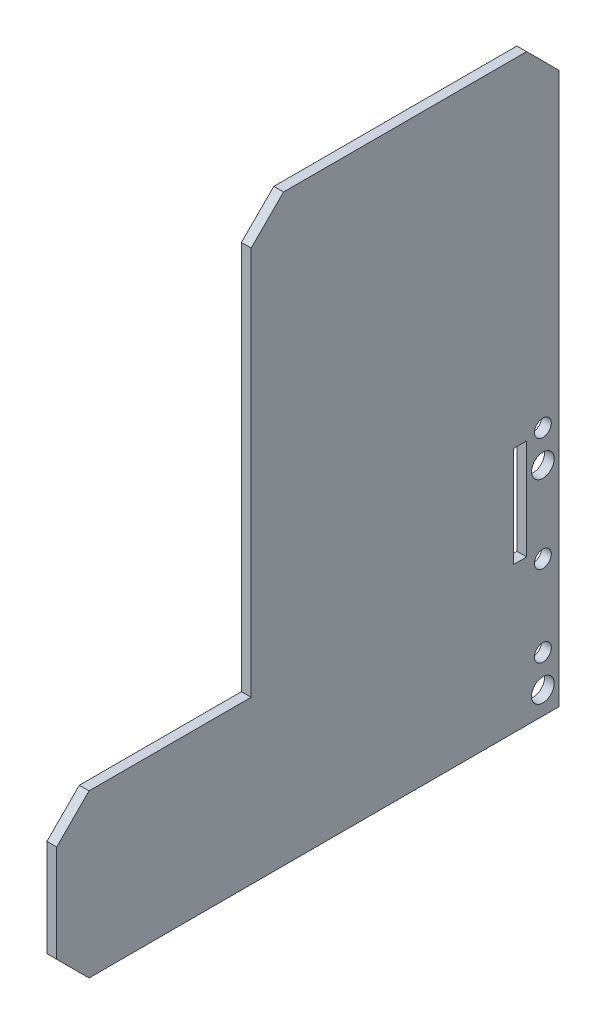
from build123d import *

# Parameters (mm, degrees)
ESQUISSE1_W                            = 77.5
ESQUISSE1_H                            = 90
ESQUISSE1_R                            = 1.75
EXTRUSION1_DEPTH                       = 1.5
FRAISAGE_POUR_VIS_T_TE_FRAIS_E_M2_51_D = 2.59999988
ESQUISSE5_W                            = 2
ESQUISSE5_H                            = 15.5
ENL_V_MAT_EXTRU_1_DEPTH                = 102.922764876
ENL_V_MAT_EXTRU_2_REACH                = 103.923


with BuildPart() as part:
    # Esquisse1 → Extrusion1 (new body)
    with BuildSketch(Plane(origin=(0, 0, 0), x_dir=(0, 0, -1), z_dir=(1, 0, 0))):
        with Locations((-36.25, 24)):
            Rectangle(ESQUISSE1_W, ESQUISSE1_H)
        with Locations((0, -17.5)):
            Circle(ESQUISSE1_R, mode=Mode.SUBTRACT)
        with Locations((0, 12.5)):
            Circle(ESQUISSE1_R, mode=Mode.SUBTRACT)
    extrude(amount=EXTRUSION1_DEPTH)

    # Fraisage pour vis à tête fraisée M2.51 (through all)
    with Locations(Plane(origin=(1.5, 0, 0), x_dir=(0, 0, -1), z_dir=(1, 0, 0))):
        with Locations((0, 17.5), (0, -12.5), (0, 0)):
            Hole(FRAISAGE_POUR_VIS_T_TE_FRAIS_E_M2_51_D / 2)

    # Esquisse5 → Enlèv. mat.-Extru.1 (cut, through all)
    with BuildSketch(Plane.ZY):
        with Locations((3.5, 9.25)):
            Rectangle(ESQUISSE5_W, ESQUISSE5_H)
    extrude(amount=-ENL_V_MAT_EXTRU_1_DEPTH, mode=Mode.SUBTRACT)

    # Esquisse6 → Enlèv. mat.-Extru.2 (cut, up to next)
    with BuildSketch(Plane(origin=(1.5, 0, 0), x_dir=(0, 0, -1), z_dir=(1, 0, 0)), mode=Mode.PRIVATE) as enl_v_mat_extru_2_sk1:
        Polygon((-75, 69), (-75, -1), (-70, 4), (-45, 4), (-45, 64), (-40, 69), align=None)
    enl_v_mat_extru_2_tool1 = extrude(enl_v_mat_extru_2_sk1.sketch, amount=-ENL_V_MAT_EXTRU_2_REACH, mode=Mode.PRIVATE) & part.part
    # Esquisse6 → Enlèv. mat.-Extru.2 (cut, up to next)
    with BuildSketch(Plane(origin=(1.5, 0, 0), x_dir=(0, 0, -1), z_dir=(1, 0, 0)), mode=Mode.PRIVATE) as enl_v_mat_extru_2_sk2:
        Polygon((-75, -21), (-70, -21), (-75, -16), align=None)
    enl_v_mat_extru_2_tool2 = extrude(enl_v_mat_extru_2_sk2.sketch, amount=-ENL_V_MAT_EXTRU_2_REACH, mode=Mode.PRIVATE) & part.part
    # Esquisse6 → Enlèv. mat.-Extru.2 (cut, up to next)
    with BuildSketch(Plane(origin=(1.5, 0, 0), x_dir=(0, 0, -1), z_dir=(1, 0, 0)), mode=Mode.PRIVATE) as enl_v_mat_extru_2_sk3:
        Polygon((2.5, 69), (2.5, 64), (-2.5, 69), align=None)
    enl_v_mat_extru_2_tool3 = extrude(enl_v_mat_extru_2_sk3.sketch, amount=-ENL_V_MAT_EXTRU_2_REACH, mode=Mode.PRIVATE) & part.part
    add(enl_v_mat_extru_2_tool1.solids().sort_by_distance((1.5, 36.478903, 59.978903))[0], mode=Mode.SUBTRACT)
    add(enl_v_mat_extru_2_tool2.solids().sort_by_distance((1.5, -19.333333, 73.333333))[0], mode=Mode.SUBTRACT)
    add(enl_v_mat_extru_2_tool3.solids().sort_by_distance((1.5, 67.333333, -0.833333))[0], mode=Mode.SUBTRACT)


solid = part.part
